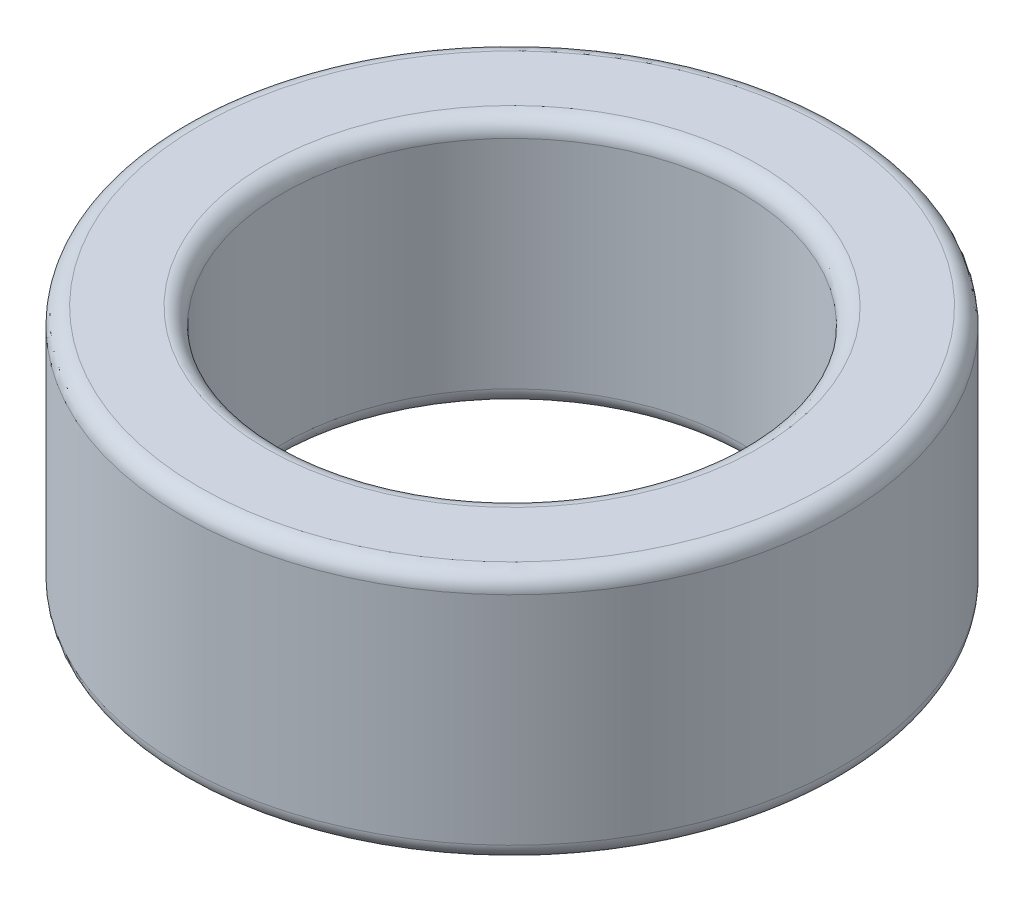
from build123d import *

# Parameters (mm, degrees)
SKETCH1_R                = 3.95
BOSS_EXTRUDE1_DEPTH      = 3
M5_CLEARANCE_HOLE1_D     = 5.5
M5_CLEARANCE_HOLE1_DEPTH = 3
M5_CLEARANCE_HOLE1_TIP   = 1.652366702
FILLET1_R                = 0.2


with BuildPart() as part:
    # Sketch1 → Boss-Extrude1 (new body)
    with BuildSketch(Plane(origin=(0, 0, 0), x_dir=(1, 0, 0), z_dir=(0, 1, 0))):
        Circle(SKETCH1_R)
    extrude(amount=BOSS_EXTRUDE1_DEPTH)

    # M5 Clearance Hole1
    with Locations(Plane(origin=(0, 3, 0), x_dir=(1, 0, 0), z_dir=(0, 1, 0))):
        with Locations((0, 0)):
            Hole(M5_CLEARANCE_HOLE1_D / 2, depth=M5_CLEARANCE_HOLE1_DEPTH)
            with Locations((0, 0, -(M5_CLEARANCE_HOLE1_DEPTH + M5_CLEARANCE_HOLE1_TIP / 2))):  # 118° drill point
                Cone(0, M5_CLEARANCE_HOLE1_D / 2, M5_CLEARANCE_HOLE1_TIP, mode=Mode.SUBTRACT)

    # Fillet1
    fillet1_edges = [part.edges().sort_by_distance(p)[0] for p in [
        (-3.95, 0, 0),
        (-3.95, 3, 0),
        (2.75, 0, 0),
        (2.75, 3, 0),
    ]]
    fillet(fillet1_edges, radius=FILLET1_R)


solid = part.part
